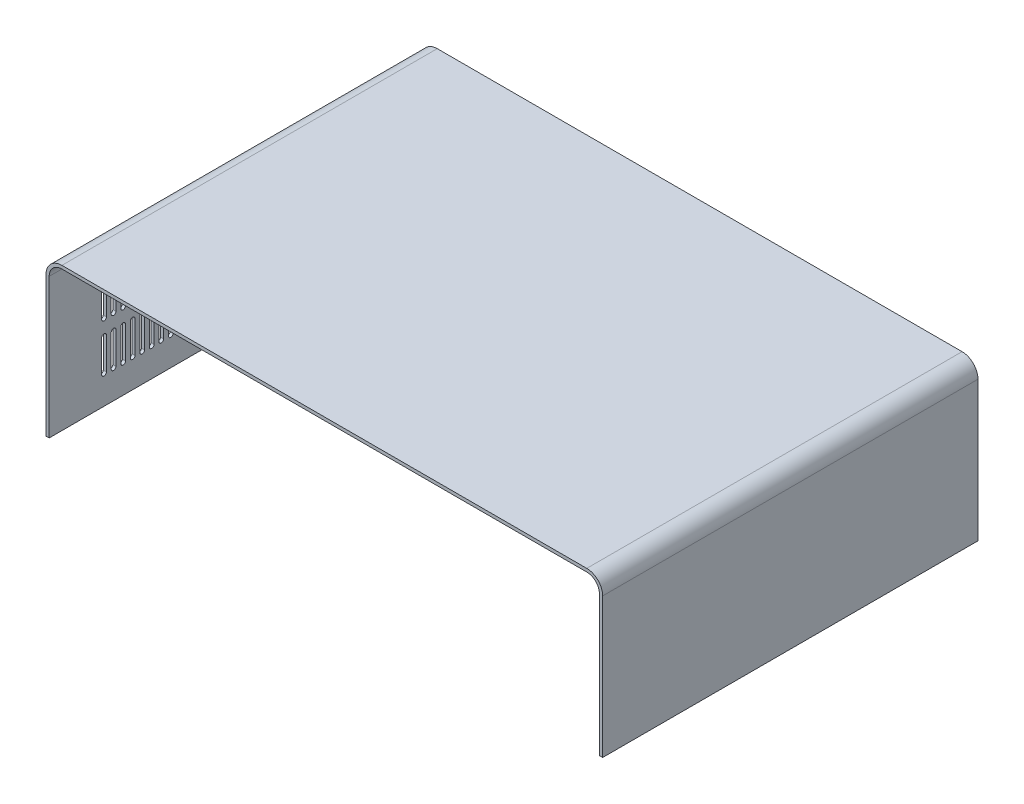
from build123d import *

# Parameters (mm, degrees)
EXTRUDE1_DEPTH = 118
EXTRUDE2_DEPTH = 1


with BuildPart() as part:
    # Sketch1 → Extrude1 (new body)
    with BuildSketch(Plane.XY):
        with BuildLine():
            Line((-87.5, 0), (-87.5, 44))
            ThreePointArc((-87.5, 44), (-86.035533906, 47.535533906), (-82.5, 49))
            Line((-82.5, 49), (82.5, 49))
            ThreePointArc((82.5, 49), (86.035533906, 47.535533906), (87.5, 44))
            Line((87.5, 44), (87.5, 0))
            Line((87.5, 0), (86.5, 0))
            Line((86.5, 0), (86.5, 44))
            ThreePointArc((86.5, 44), (85.328427125, 46.828427125), (82.5, 48))
            Line((82.5, 48), (-82.5, 48))
            ThreePointArc((-82.5, 48), (-85.328427125, 46.828427125), (-86.5, 44))
            Line((-86.5, 44), (-86.5, 0))
            Line((-86.5, 0), (-87.5, 0))
        make_face()
    extrude(amount=-EXTRUDE1_DEPTH)

    # Sketch2 → Extrude2 (cut)
    with BuildSketch(Plane.ZY.offset(87.5)):
        with BuildLine():
            Line((-75, 34), (-75, 24))
            ThreePointArc((-75, 24), (-74.25, 23.25), (-73.5, 24))
            Line((-73.5, 24), (-73.5, 34))
            ThreePointArc((-73.5, 34), (-74.25, 34.75), (-75, 34))
        make_face()
        with BuildLine():
            Line((-72, 34), (-72, 24))
            ThreePointArc((-72, 24), (-71.25, 23.25), (-70.5, 24))
            Line((-70.5, 24), (-70.5, 34))
            ThreePointArc((-70.5, 34), (-71.25, 34.75), (-72, 34))
        make_face()
        with BuildLine():
            Line((-69, 34), (-69, 24))
            ThreePointArc((-69, 24), (-68.25, 23.25), (-67.5, 24))
            Line((-67.5, 24), (-67.5, 34))
            ThreePointArc((-67.5, 34), (-68.25, 34.75), (-69, 34))
        make_face()
        with BuildLine():
            Line((-66, 34), (-66, 24))
            ThreePointArc((-66, 24), (-65.25, 23.25), (-64.5, 24))
            Line((-64.5, 24), (-64.5, 34))
            ThreePointArc((-64.5, 34), (-65.25, 34.75), (-66, 34))
        make_face()
        with BuildLine():
            Line((-63, 34), (-63, 24))
            ThreePointArc((-63, 24), (-62.25, 23.25), (-61.5, 24))
            Line((-61.5, 24), (-61.5, 34))
            ThreePointArc((-61.5, 34), (-62.25, 34.75), (-63, 34))
        make_face()
        with BuildLine():
            Line((-60, 34), (-60, 24))
            ThreePointArc((-60, 24), (-59.25, 23.25), (-58.5, 24))
            Line((-58.5, 24), (-58.5, 34))
            ThreePointArc((-58.5, 34), (-59.25, 34.75), (-60, 34))
        make_face()
        with BuildLine():
            Line((-57, 34), (-57, 24))
            ThreePointArc((-57, 24), (-56.25, 23.25), (-55.5, 24))
            Line((-55.5, 24), (-55.5, 34))
            ThreePointArc((-55.5, 34), (-56.25, 34.75), (-57, 34))
        make_face()
        with BuildLine():
            Line((-54, 34), (-54, 24))
            ThreePointArc((-54, 24), (-53.25, 23.25), (-52.5, 24))
            Line((-52.5, 24), (-52.5, 34))
            ThreePointArc((-52.5, 34), (-53.25, 34.75), (-54, 34))
        make_face()
        with BuildLine():
            Line((-51, 34), (-51, 24))
            ThreePointArc((-51, 24), (-50.25, 23.25), (-49.5, 24))
            Line((-49.5, 24), (-49.5, 34))
            ThreePointArc((-49.5, 34), (-50.25, 34.75), (-51, 34))
        make_face()
        with BuildLine():
            Line((-48, 34), (-48, 24))
            ThreePointArc((-48, 24), (-47.25, 23.25), (-46.5, 24))
            Line((-46.5, 24), (-46.5, 34))
            ThreePointArc((-46.5, 34), (-47.25, 34.75), (-48, 34))
        make_face()
        with BuildLine():
            Line((-45, 34), (-45, 24))
            ThreePointArc((-45, 24), (-44.25, 23.25), (-43.5, 24))
            Line((-43.5, 24), (-43.5, 34))
            ThreePointArc((-43.5, 34), (-44.25, 34.75), (-45, 34))
        make_face()
        with BuildLine():
            Line((-42, 34), (-42, 24))
            ThreePointArc((-42, 24), (-41.25, 23.25), (-40.5, 24))
            Line((-40.5, 24), (-40.5, 34))
            ThreePointArc((-40.5, 34), (-41.25, 34.75), (-42, 34))
        make_face()
        with BuildLine():
            Line((-39, 34), (-39, 24))
            ThreePointArc((-39, 24), (-38.25, 23.25), (-37.5, 24))
            Line((-37.5, 24), (-37.5, 34))
            ThreePointArc((-37.5, 34), (-38.25, 34.75), (-39, 34))
        make_face()
        with BuildLine():
            Line((-36, 34), (-36, 24))
            ThreePointArc((-36, 24), (-35.25, 23.25), (-34.5, 24))
            Line((-34.5, 24), (-34.5, 34))
            ThreePointArc((-34.5, 34), (-35.25, 34.75), (-36, 34))
        make_face()
        with BuildLine():
            Line((-33, 34), (-33, 24))
            ThreePointArc((-33, 24), (-32.25, 23.25), (-31.5, 24))
            Line((-31.5, 24), (-31.5, 34))
            ThreePointArc((-31.5, 34), (-32.25, 34.75), (-33, 34))
        make_face()
        with BuildLine():
            Line((-30, 34), (-30, 24))
            ThreePointArc((-30, 24), (-29.25, 23.25), (-28.5, 24))
            Line((-28.5, 24), (-28.5, 34))
            ThreePointArc((-28.5, 34), (-29.25, 34.75), (-30, 34))
        make_face()
        with BuildLine():
            Line((-27, 34), (-27, 24))
            ThreePointArc((-27, 24), (-26.25, 23.25), (-25.5, 24))
            Line((-25.5, 24), (-25.5, 34))
            ThreePointArc((-25.5, 34), (-26.25, 34.75), (-27, 34))
        make_face()
        with BuildLine():
            Line((-24, 34), (-24, 24))
            ThreePointArc((-24, 24), (-23.25, 23.25), (-22.5, 24))
            Line((-22.5, 24), (-22.5, 34))
            ThreePointArc((-22.5, 34), (-23.25, 34.75), (-24, 34))
        make_face()
        with BuildLine():
            Line((-21, 34), (-21, 24))
            ThreePointArc((-21, 24), (-20.25, 23.25), (-19.5, 24))
            Line((-19.5, 24), (-19.5, 34))
            ThreePointArc((-19.5, 34), (-20.25, 34.75), (-21, 34))
        make_face()
        with BuildLine():
            Line((-18, 34), (-18, 24))
            ThreePointArc((-18, 24), (-17.25, 23.25), (-16.5, 24))
            Line((-16.5, 24), (-16.5, 34))
            ThreePointArc((-16.5, 34), (-17.25, 34.75), (-18, 34))
        make_face()
        with BuildLine():
            Line((-75, 19), (-75, 9))
            ThreePointArc((-75, 9), (-74.25, 8.25), (-73.5, 9))
            Line((-73.5, 9), (-73.5, 19))
            ThreePointArc((-73.5, 19), (-74.25, 19.75), (-75, 19))
        make_face()
        with BuildLine():
            Line((-72, 19), (-72, 9))
            ThreePointArc((-72, 9), (-71.25, 8.25), (-70.5, 9))
            Line((-70.5, 9), (-70.5, 19))
            ThreePointArc((-70.5, 19), (-71.25, 19.75), (-72, 19))
        make_face()
        with BuildLine():
            Line((-69, 19), (-69, 9))
            ThreePointArc((-69, 9), (-68.25, 8.25), (-67.5, 9))
            Line((-67.5, 9), (-67.5, 19))
            ThreePointArc((-67.5, 19), (-68.25, 19.75), (-69, 19))
        make_face()
        with BuildLine():
            Line((-66, 19), (-66, 9))
            ThreePointArc((-66, 9), (-65.25, 8.25), (-64.5, 9))
            Line((-64.5, 9), (-64.5, 19))
            ThreePointArc((-64.5, 19), (-65.25, 19.75), (-66, 19))
        make_face()
        with BuildLine():
            Line((-63, 19), (-63, 9))
            ThreePointArc((-63, 9), (-62.25, 8.25), (-61.5, 9))
            Line((-61.5, 9), (-61.5, 19))
            ThreePointArc((-61.5, 19), (-62.25, 19.75), (-63, 19))
        make_face()
        with BuildLine():
            Line((-60, 19), (-60, 9))
            ThreePointArc((-60, 9), (-59.25, 8.25), (-58.5, 9))
            Line((-58.5, 9), (-58.5, 19))
            ThreePointArc((-58.5, 19), (-59.25, 19.75), (-60, 19))
        make_face()
        with BuildLine():
            Line((-57, 19), (-57, 9))
            ThreePointArc((-57, 9), (-56.25, 8.25), (-55.5, 9))
            Line((-55.5, 9), (-55.5, 19))
            ThreePointArc((-55.5, 19), (-56.25, 19.75), (-57, 19))
        make_face()
        with BuildLine():
            Line((-54, 19), (-54, 9))
            ThreePointArc((-54, 9), (-53.25, 8.25), (-52.5, 9))
            Line((-52.5, 9), (-52.5, 19))
            ThreePointArc((-52.5, 19), (-53.25, 19.75), (-54, 19))
        make_face()
        with BuildLine():
            Line((-51, 19), (-51, 9))
            ThreePointArc((-51, 9), (-50.25, 8.25), (-49.5, 9))
            Line((-49.5, 9), (-49.5, 19))
            ThreePointArc((-49.5, 19), (-50.25, 19.75), (-51, 19))
        make_face()
        with BuildLine():
            Line((-48, 19), (-48, 9))
            ThreePointArc((-48, 9), (-47.25, 8.25), (-46.5, 9))
            Line((-46.5, 9), (-46.5, 19))
            ThreePointArc((-46.5, 19), (-47.25, 19.75), (-48, 19))
        make_face()
        with BuildLine():
            Line((-45, 19), (-45, 9))
            ThreePointArc((-45, 9), (-44.25, 8.25), (-43.5, 9))
            Line((-43.5, 9), (-43.5, 19))
            ThreePointArc((-43.5, 19), (-44.25, 19.75), (-45, 19))
        make_face()
        with BuildLine():
            Line((-42, 19), (-42, 9))
            ThreePointArc((-42, 9), (-41.25, 8.25), (-40.5, 9))
            Line((-40.5, 9), (-40.5, 19))
            ThreePointArc((-40.5, 19), (-41.25, 19.75), (-42, 19))
        make_face()
        with BuildLine():
            Line((-39, 19), (-39, 9))
            ThreePointArc((-39, 9), (-38.25, 8.25), (-37.5, 9))
            Line((-37.5, 9), (-37.5, 19))
            ThreePointArc((-37.5, 19), (-38.25, 19.75), (-39, 19))
        make_face()
        with BuildLine():
            Line((-36, 19), (-36, 9))
            ThreePointArc((-36, 9), (-35.25, 8.25), (-34.5, 9))
            Line((-34.5, 9), (-34.5, 19))
            ThreePointArc((-34.5, 19), (-35.25, 19.75), (-36, 19))
        make_face()
        with BuildLine():
            Line((-33, 19), (-33, 9))
            ThreePointArc((-33, 9), (-32.25, 8.25), (-31.5, 9))
            Line((-31.5, 9), (-31.5, 19))
            ThreePointArc((-31.5, 19), (-32.25, 19.75), (-33, 19))
        make_face()
        with BuildLine():
            Line((-30, 19), (-30, 9))
            ThreePointArc((-30, 9), (-29.25, 8.25), (-28.5, 9))
            Line((-28.5, 9), (-28.5, 19))
            ThreePointArc((-28.5, 19), (-29.25, 19.75), (-30, 19))
        make_face()
        with BuildLine():
            Line((-27, 19), (-27, 9))
            ThreePointArc((-27, 9), (-26.25, 8.25), (-25.5, 9))
            Line((-25.5, 9), (-25.5, 19))
            ThreePointArc((-25.5, 19), (-26.25, 19.75), (-27, 19))
        make_face()
        with BuildLine():
            Line((-24, 19), (-24, 9))
            ThreePointArc((-24, 9), (-23.25, 8.25), (-22.5, 9))
            Line((-22.5, 9), (-22.5, 19))
            ThreePointArc((-22.5, 19), (-23.25, 19.75), (-24, 19))
        make_face()
        with BuildLine():
            Line((-21, 19), (-21, 9))
            ThreePointArc((-21, 9), (-20.25, 8.25), (-19.5, 9))
            Line((-19.5, 9), (-19.5, 19))
            ThreePointArc((-19.5, 19), (-20.25, 19.75), (-21, 19))
        make_face()
        with BuildLine():
            Line((-18, 19), (-18, 9))
            ThreePointArc((-18, 9), (-17.25, 8.25), (-16.5, 9))
            Line((-16.5, 9), (-16.5, 19))
            ThreePointArc((-16.5, 19), (-17.25, 19.75), (-18, 19))
        make_face()
    extrude(amount=-EXTRUDE2_DEPTH, mode=Mode.SUBTRACT)


solid = part.part
